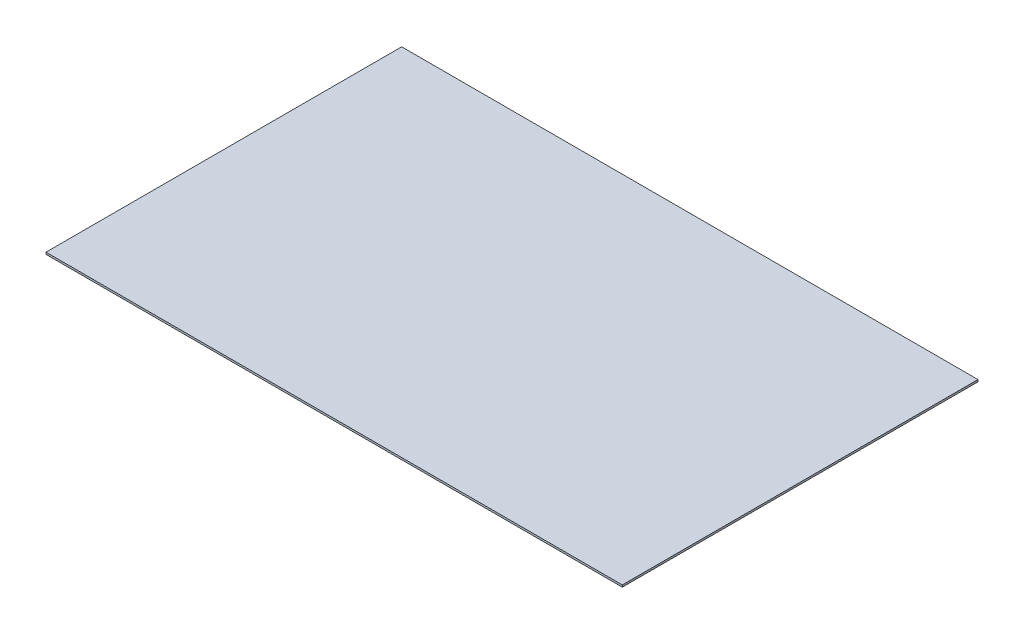
from build123d import *

# Parameters (mm, degrees)
SKETCH1_W           = 875
SKETCH1_H           = 540
BOSS_EXTRUDE1_DEPTH = 3


with BuildPart() as part:
    # Sketch1 → Boss-Extrude1 (new body)
    with BuildSketch(Plane(origin=(0, 0, 0), x_dir=(1, 0, 0), z_dir=(0, 1, 0))):
        Rectangle(SKETCH1_W, SKETCH1_H)
    extrude(amount=BOSS_EXTRUDE1_DEPTH)


solid = part.part
